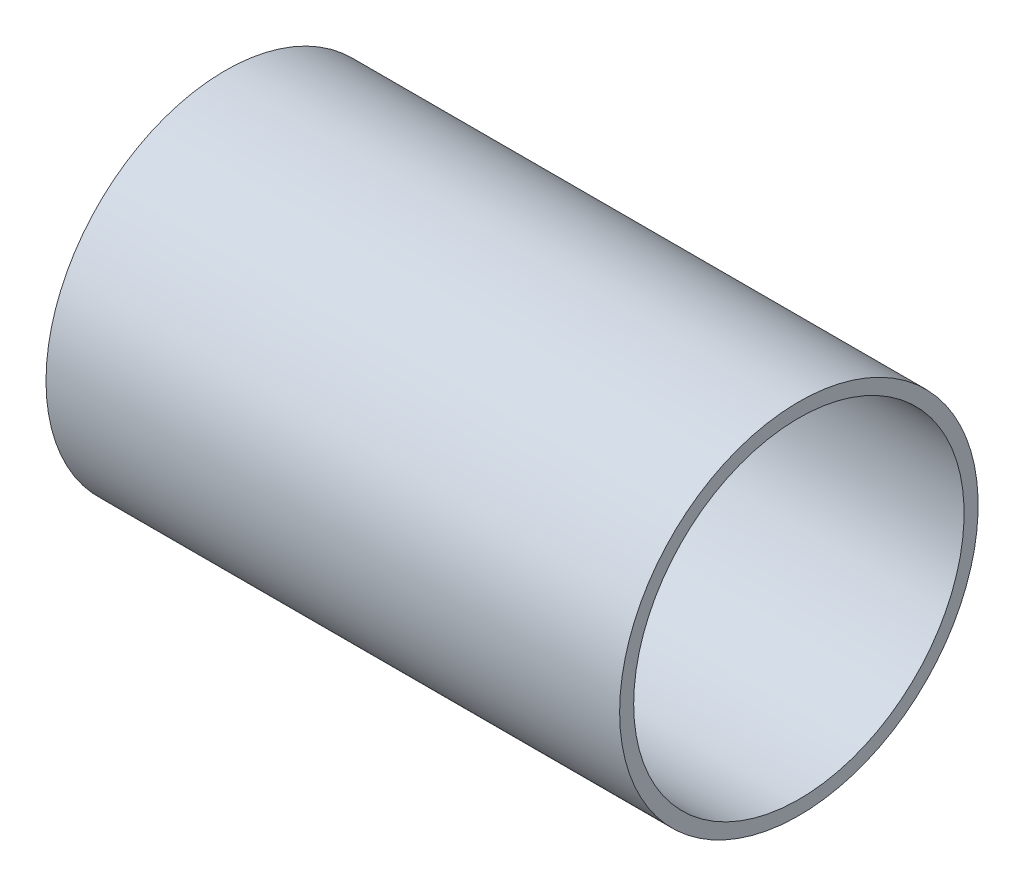
from build123d import *

# Parameters (mm, degrees)
SKETCH1_W = 50.8
SKETCH1_H = 1.2446


with BuildPart() as part:
    # Sketch1 → Revolve1 (revolve)
    with BuildSketch(Plane(origin=(0, 0, 0), x_dir=(1, 0, 0), z_dir=(0, 1, 0)), mode=Mode.PRIVATE) as revolve1_sk:
        with Locations((0, 15.2527)):
            Rectangle(SKETCH1_W, SKETCH1_H)
    revolve(revolve1_sk.sketch.rotate(Axis((-72.893991897, 0, 0), (1, 0, 0)), 180), axis=Axis((-72.893991897, 0, 0), (1, 0, 0)))


solid = part.part
